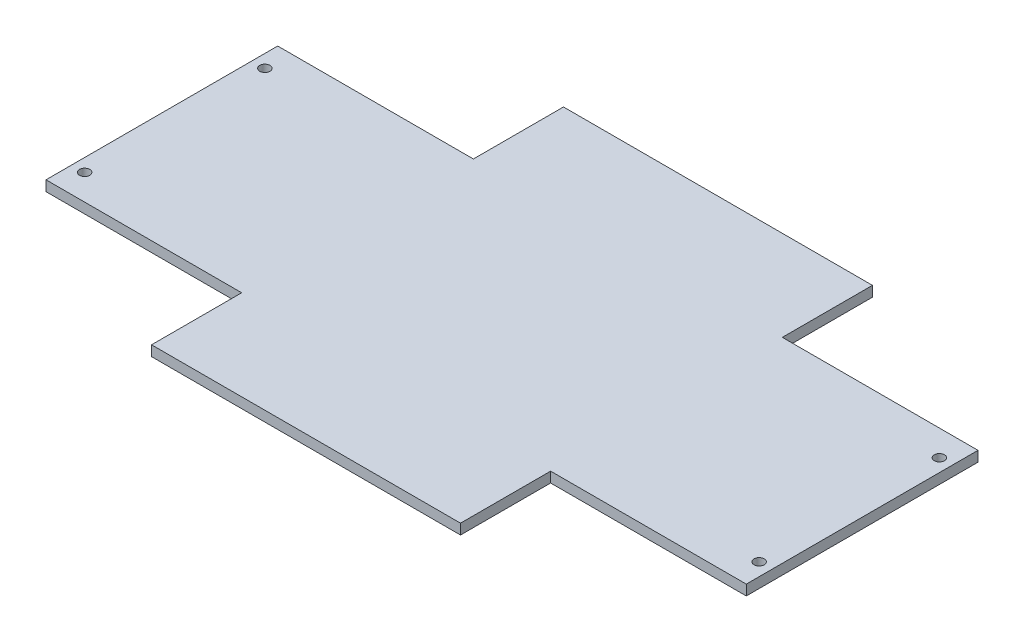
from build123d import *

# Parameters (mm, degrees)
BOSS_EXTRUDE1_DEPTH      = 2
M2_CLEARANCE_HOLE1_D     = 2
M2_CLEARANCE_HOLE1_DEPTH = 2
M2_CLEARANCE_HOLE1_TIP   = 0.600860619


with BuildPart() as part:
    # Sketch1 → Boss-Extrude1 (new body)
    with BuildSketch(Plane(origin=(0, 0, 0), x_dir=(1, 0, 0), z_dir=(0, 1, 0))):
        Polygon((98, 45), (136, 45), (136, 0), (98, 0), (98, -17.5), (38, -17.5), (38, 0), (0, 0), (0, 45), (38, 45), (38, 62.5), (98, 62.5), align=None)
    extrude(amount=BOSS_EXTRUDE1_DEPTH)

    # M2 Clearance Hole1
    with Locations(Plane(origin=(0, 2, 0), x_dir=(1, 0, 0), z_dir=(0, 1, 0))):
        with Locations((2.5, 5), (2.5, 40), (133.5, 40), (133.5, 5)):
            Hole(M2_CLEARANCE_HOLE1_D / 2, depth=M2_CLEARANCE_HOLE1_DEPTH)
            with Locations((0, 0, -(M2_CLEARANCE_HOLE1_DEPTH + M2_CLEARANCE_HOLE1_TIP / 2))):  # 118° drill point
                Cone(0, M2_CLEARANCE_HOLE1_D / 2, M2_CLEARANCE_HOLE1_TIP, mode=Mode.SUBTRACT)


solid = part.part
